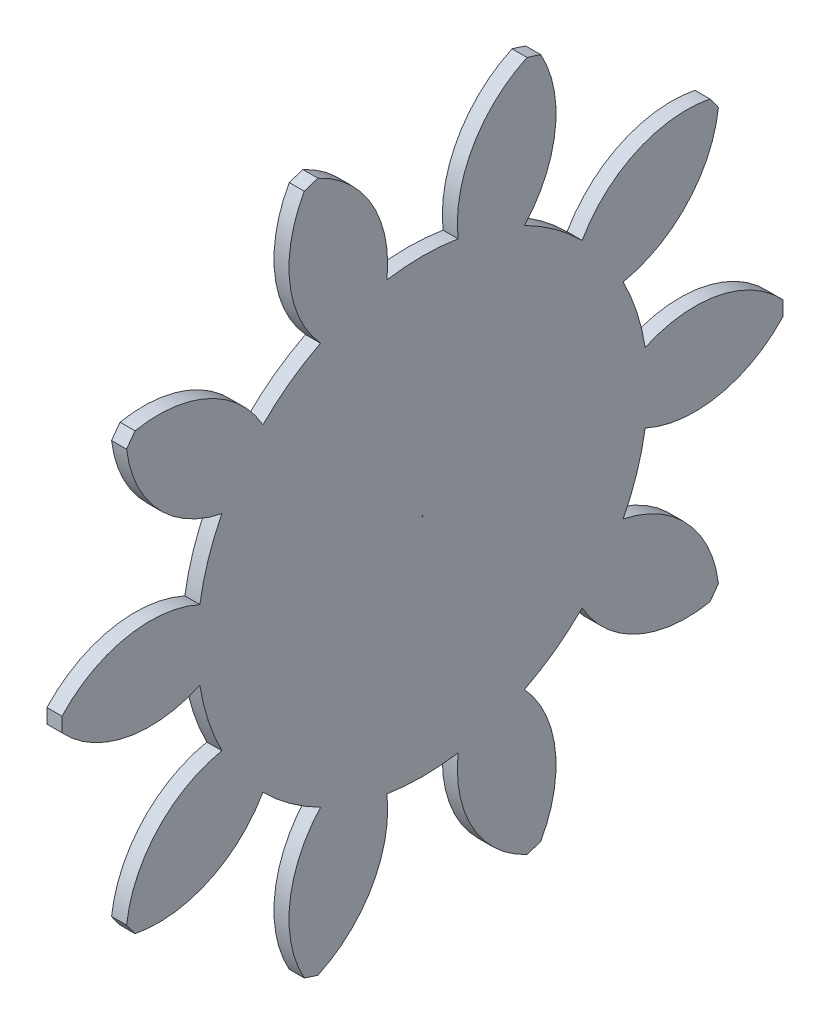
from build123d import *

# Parameters (mm, degrees)
BASPROSKE_W     = 12.7
BASPROSKE_H     = 304.8
TOOTHCUT_DEPTH  = 432.239341897
TEETHCUTS_COUNT = 10
TEETHCUTS_ANGLE = 324
BORSKE_R        = 0.396875
BORE_DEPTH      = 50.8000508


with BuildPart() as part:
    # BasProSke → Base-Revolve (revolve)
    with BuildSketch(Plane(origin=(0, 0, 0), x_dir=(1, 0, 0), z_dir=(0, 1, 0)), mode=Mode.PRIVATE) as base_revolve_sk:
        with Locations((6.35, 152.4)):
            Rectangle(BASPROSKE_W, BASPROSKE_H)
    revolve(base_revolve_sk.sketch.rotate(Axis((-10, 0, 0), (1, 0, 0)), 180), axis=Axis((-10, 0, 0), (1, 0, 0)))

    # TooCutSke → ToothCut (cut, through all)
    with BuildSketch(Plane(origin=(0, 0, 0), x_dir=(0, 0, -1), z_dir=(1, 0, 0))):
        with BuildLine():
            ThreePointArc((30.074344953, 188.10980811), (0, 190.49873), (-30.074344953, 188.10980811))
            ThreePointArc((-30.074344953, 188.10980811), (-42.50109663, 249.341412607), (-88.408843299, 291.723157997))
            ThreePointArc((-88.408843299, 291.723157997), (0, 304.8254), (88.408843299, 291.723157997))
            ThreePointArc((88.408843299, 291.723157997), (42.50109663, 249.341412607), (30.074344953, 188.10980811))
        make_face()
    toothcut = extrude(amount=TOOTHCUT_DEPTH, mode=Mode.SUBTRACT)

    # TeethCuts: ToothCut ×10 about axis
    teethcuts_axis = Axis((-10, 0, 0), (1, 0, 0))
    for i in range(1, TEETHCUTS_COUNT):
        add(toothcut.rotate(teethcuts_axis, i * TEETHCUTS_ANGLE / (TEETHCUTS_COUNT - 1)), mode=Mode.SUBTRACT)

    # BorSke → Bore (cut, symmetric)
    with BuildSketch(Plane(origin=(0, 0, 0), x_dir=(0, 0, -1), z_dir=(1, 0, 0))):
        with Locations(Location((0, 0, 0), (0, 0, 180))):
            Circle(BORSKE_R)
    extrude(amount=BORE_DEPTH, both=True, mode=Mode.SUBTRACT)


solid = part.part
